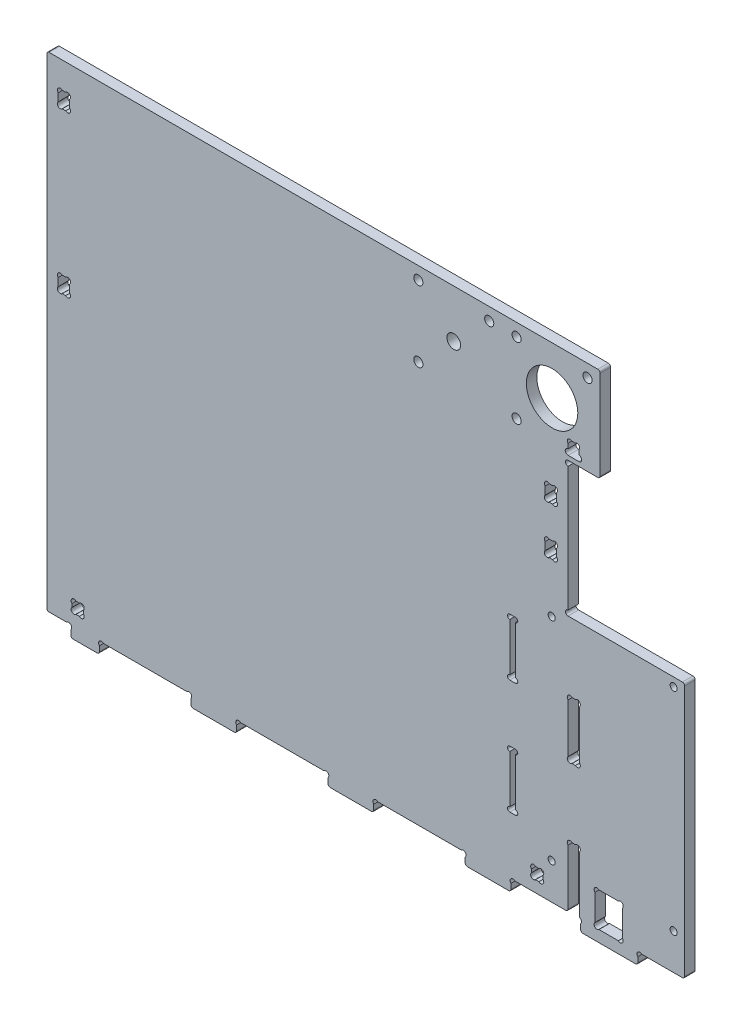
from build123d import *

# Parameters (mm, degrees)
SKETCH1_W           = 5
SKETCH1_H           = 5
SKETCH1_H_2         = 7
SKETCH1_W_2         = 4.7
SKETCH1_H_3         = 6.2
BOSS_EXTRUDE1_DEPTH = 4.6
SKETCH2_R           = 11.25
SKETCH2_R_2         = 2
SKETCH2_R_3         = 3
CUT_EXTRUDE1_DEPTH  = 322.759475385
SKETCH9_W           = 5
SKETCH9_H           = 30
BOSS_EXTRUDE2_DEPTH = 4.6
SKETCH13_W          = 46
SKETCH13_H          = 112
BOSS_EXTRUDE4_DEPTH = 4.6
SKETCH14_W          = 25
SKETCH14_H          = 5
BOSS_EXTRUDE5_DEPTH = 4.6
SKETCH17_W          = 2.5
SKETCH17_H          = 25
CUT_EXTRUDE17_DEPTH = 351.437098493
SKETCH19_W          = 12
SKETCH19_H          = 15
CUT_EXTRUDE20_DEPTH = 351.437098493
SKETCH16_R          = 1.25
SKETCH16_R_2        = 1.125
CUT_EXTRUDE13_DEPTH = 351.437098493
SKETCH18_R          = 1.55
CUT_EXTRUDE18_DEPTH = 351.437098493
FILLET1_R           = 1


with BuildPart() as part:
    # Sketch1 → Boss-Extrude1 (new body)
    with BuildSketch(Plane.XY):
        Polygon((0, 0), (10.5, 0), (10.5, -5), (23, -5), (23, 0), (63, 0), (63, -5), (83, -5), (83, 0), (123, 0), (123, -5), (143, -5), (143, 0), (183, 0), (183, -5), (203, -5), (203, 0), (228, 0), (228, 50), (228, 75), (228, 170.97), (242, 170.97), (242, 172.67), (242, 212), (183.445287707, 212), (161.996899732, 212), (0, 212), align=None)
        with Locations((214.5, 7.5)):
            Rectangle(SKETCH1_W, SKETCH1_H, mode=Mode.SUBTRACT)
        with Locations((13.5, 7.5)):
            Rectangle(SKETCH1_W, SKETCH1_H, mode=Mode.SUBTRACT)
        with Locations((220.5, 133.5)):
            Rectangle(SKETCH1_W, SKETCH1_H_2, mode=Mode.SUBTRACT)
        with Locations((220.5, 154.5)):
            Rectangle(SKETCH1_W, SKETCH1_H_2, mode=Mode.SUBTRACT)
        with Locations((7.5, 197)):
            Rectangle(SKETCH1_W, SKETCH1_H_2, mode=Mode.SUBTRACT)
        with Locations((7.5, 127)):
            Rectangle(SKETCH1_W, SKETCH1_H_2, mode=Mode.SUBTRACT)
        with Locations((230.35, 175.97)):
            Rectangle(SKETCH1_W_2, SKETCH1_H_3, mode=Mode.SUBTRACT)
    extrude(amount=BOSS_EXTRUDE1_DEPTH)

    # Sketch2 → Cut-Extrude1 (cut, through all)
    with BuildSketch(Plane.XY.offset(4.6)):
        with Locations((221, 191)):
            Circle(SKETCH2_R)
        with Locations((205.5, 206.5)):
            Circle(SKETCH2_R_2)
        with Locations((205.5, 175.5)):
            Circle(SKETCH2_R_2)
        with Locations((236.5, 206.5)):
            Circle(SKETCH2_R_2)
        with Locations((162.5, 206.5)):
            Circle(SKETCH2_R_2)
        with Locations((162.5, 175.5)):
            Circle(SKETCH2_R_2)
        with Locations((193.5, 206.5)):
            Circle(SKETCH2_R_2)
        with Locations((178, 191)):
            Circle(SKETCH2_R_3)
    extrude(amount=-CUT_EXTRUDE1_DEPTH, mode=Mode.SUBTRACT)

    # Sketch9 → Boss-Extrude2 (add)
    with BuildSketch(Plane.XY.offset(4.6)):
        with Locations((230.5, 97)):
            Rectangle(SKETCH9_W, SKETCH9_H)
        with Locations((230.5, 42)):
            Rectangle(SKETCH9_W, SKETCH9_H)
    extrude(amount=-BOSS_EXTRUDE2_DEPTH)

    # Sketch13 → Boss-Extrude4 (add)
    with BuildSketch(Plane.XY.offset(4.6)):
        with Locations((256, 56)):
            Rectangle(SKETCH13_W, SKETCH13_H)
    extrude(amount=-BOSS_EXTRUDE4_DEPTH)

    # Sketch14 → Boss-Extrude5 (add)
    with BuildSketch(Plane.XY.offset(4.6)):
        with Locations((246, -2.5)):
            Rectangle(SKETCH14_W, SKETCH14_H)
    extrude(amount=-BOSS_EXTRUDE5_DEPTH)

    # Sketch17 → Cut-Extrude17 (cut, through all)
    with BuildSketch(Plane.XY.offset(4.6)):
        with Locations((203.75, 87.5)):
            Rectangle(SKETCH17_W, SKETCH17_H)
        with Locations((203.75, 37.5)):
            Rectangle(SKETCH17_W, SKETCH17_H)
    extrude(amount=-CUT_EXTRUDE17_DEPTH, mode=Mode.SUBTRACT)

    # Sketch19 → Cut-Extrude20 (cut, through all)
    with BuildSketch(Plane.XY.offset(4.6)):
        with Locations((245.75, 7.5)):
            Rectangle(SKETCH19_W, SKETCH19_H)
    extrude(amount=-CUT_EXTRUDE20_DEPTH, mode=Mode.SUBTRACT)

    # Sketch16 → Cut-Extrude13 (cut, through all)
    with BuildSketch(Plane.XY.offset(4.6)):
        with Locations((5.883883476, 199.616116524)):
            Circle(SKETCH16_R)
        with Locations((9.116116524, 199.616116524)):
            Circle(SKETCH16_R)
        with Locations((9.116116524, 194.383883476)):
            Circle(SKETCH16_R)
        with Locations((5.883883476, 194.383883476)):
            Circle(SKETCH16_R)
        with Locations((9.116116524, 129.616116524)):
            Circle(SKETCH16_R)
        with Locations((5.883883476, 129.616116524)):
            Circle(SKETCH16_R)
        with Locations((9.116116524, 124.383883476)):
            Circle(SKETCH16_R)
        with Locations((5.883883476, 124.383883476)):
            Circle(SKETCH16_R)
        with Locations((228, 169.845)):
            Circle(SKETCH16_R_2)
        with Locations((228, 113.125)):
            Circle(SKETCH16_R_2)
        with Locations((218.883883476, 157.116116524)):
            Circle(SKETCH16_R)
        with Locations((222.116116524, 157.116116524)):
            Circle(SKETCH16_R)
        with Locations((222.116116524, 151.883883476)):
            Circle(SKETCH16_R)
        with Locations((218.883883476, 151.883883476)):
            Circle(SKETCH16_R)
        with Locations((11.883883476, 9.116116524)):
            Circle(SKETCH16_R)
        with Locations((11.883883476, 5.883883476)):
            Circle(SKETCH16_R)
        with Locations((15.116116524, 9.116116524)):
            Circle(SKETCH16_R)
        with Locations((15.116116524, 5.883883476)):
            Circle(SKETCH16_R)
        with Locations((212.883883476, 5.883883476)):
            Circle(SKETCH16_R)
        with Locations((212.883883476, 9.116116524)):
            Circle(SKETCH16_R)
        with Locations((216.116116524, 5.883883476)):
            Circle(SKETCH16_R)
        with Locations((216.116116524, 9.116116524)):
            Circle(SKETCH16_R)
        with Locations((240.63, 14.12)):
            Circle(SKETCH16_R)
        with Locations((240.63, 0.88)):
            Circle(SKETCH16_R)
        with Locations((250.87, 0.88)):
            Circle(SKETCH16_R)
        with Locations((250.87, 14.12)):
            Circle(SKETCH16_R)
        with Locations((9.616116524, -0.883883476)):
            Circle(SKETCH16_R)
        with Locations((23.883883476, -0.883883476)):
            Circle(SKETCH16_R)
        with Locations((62.116116524, -0.883883476)):
            Circle(SKETCH16_R)
        with Locations((83.883883476, -0.883883476)):
            Circle(SKETCH16_R)
        with Locations((222.116116524, 136.116116524)):
            Circle(SKETCH16_R)
        with Locations((218.883883476, 136.116116524)):
            Circle(SKETCH16_R)
        with Locations((222.116116524, 130.883883476)):
            Circle(SKETCH16_R)
        with Locations((218.883883476, 130.883883476)):
            Circle(SKETCH16_R)
        with Locations((122.116116524, -0.883883476)):
            Circle(SKETCH16_R)
        with Locations((143.883883476, -0.883883476)):
            Circle(SKETCH16_R)
        with Locations((182.116116524, -0.883883476)):
            Circle(SKETCH16_R)
        with Locations((203.883883476, -0.883883476)):
            Circle(SKETCH16_R)
        with Locations((232.616116524, -0.883883476)):
            Circle(SKETCH16_R)
        with Locations((259.383883476, -0.883883476)):
            Circle(SKETCH16_R)
        with Locations((228.883883476, 26.116116524)):
            Circle(SKETCH16_R)
        with Locations((232.116116524, 26.116116524)):
            Circle(SKETCH16_R)
        with Locations((232.116116524, 57.883883476)):
            Circle(SKETCH16_R)
        with Locations((228.883883476, 57.883883476)):
            Circle(SKETCH16_R)
        with Locations((228.883883476, 81.116116524)):
            Circle(SKETCH16_R)
        with Locations((232.116116524, 81.116116524)):
            Circle(SKETCH16_R)
        with Locations((231.904504871, 178.274504871)):
            Circle(SKETCH16_R_2)
        with Locations((228.795495129, 178.274504871)):
            Circle(SKETCH16_R_2)
        with BuildLine():
            Line((232.7, 172.87), (228, 172.87))
            ThreePointArc((228, 172.87), (226.75, 174.12), (228, 175.37))
            Line((228, 175.37), (232.7, 175.37))
            ThreePointArc((232.7, 175.37), (233.95, 174.12), (232.7, 172.87))
        make_face()
        with BuildLine():
            Line((202.5, 25), (205, 25))
            ThreePointArc((205, 25), (206, 26), (205, 27))
            Line((205, 27), (202.5, 27))
            ThreePointArc((202.5, 27), (201.5, 26), (202.5, 25))
        make_face()
        with BuildLine():
            Line((202.5, 50), (205, 50))
            ThreePointArc((205, 50), (206, 49), (205, 48))
            Line((205, 48), (202.5, 48))
            ThreePointArc((202.5, 48), (201.5, 49), (202.5, 50))
        make_face()
        with BuildLine():
            Line((202.5, 75), (205, 75))
            ThreePointArc((205, 75), (206, 76), (205, 77))
            Line((205, 77), (202.5, 77))
            ThreePointArc((202.5, 77), (201.5, 76), (202.5, 75))
        make_face()
        with BuildLine():
            Line((202.5, 100), (205, 100))
            ThreePointArc((205, 100), (206, 99), (205, 98))
            Line((205, 98), (202.5, 98))
            ThreePointArc((202.5, 98), (201.5, 99), (202.5, 100))
        make_face()
    extrude(amount=-CUT_EXTRUDE13_DEPTH, mode=Mode.SUBTRACT)

    # Sketch18 → Cut-Extrude18 (cut, through all)
    with BuildSketch(Plane.XY.offset(4.6)):
        with Locations((274.17, 108.228)):
            Circle(SKETCH18_R)
        with Locations((220.83, 108.228)):
            Circle(SKETCH18_R)
        with Locations((274.17, 15.772)):
            Circle(SKETCH18_R)
        with Locations((220.83, 15.772)):
            Circle(SKETCH18_R)
    extrude(amount=-CUT_EXTRUDE18_DEPTH, mode=Mode.SUBTRACT)

    # Fillet1
    fillet1_edges = [part.edges().sort_by_distance(p)[0] for p in [
        (279, 0, 2.3),
        (279, 112, 2.3),
        (258.5, -5, 2.3),
        (233.5, -5, 2.3),
        (0, 212, 2.3),
        (242, 212, 2.3),
        (242, 170.97, 2.3),
        (228, 0, 2.3),
        (203, -5, 2.3),
        (183, -5, 2.3),
        (143, -5, 2.3),
        (123, -5, 2.3),
        (83, -5, 2.3),
        (63, -5, 2.3),
        (23, -5, 2.3),
        (10.5, -5, 2.3),
        (0, 0, 2.3),
    ]]
    fillet(fillet1_edges, radius=FILLET1_R)


solid = part.part
